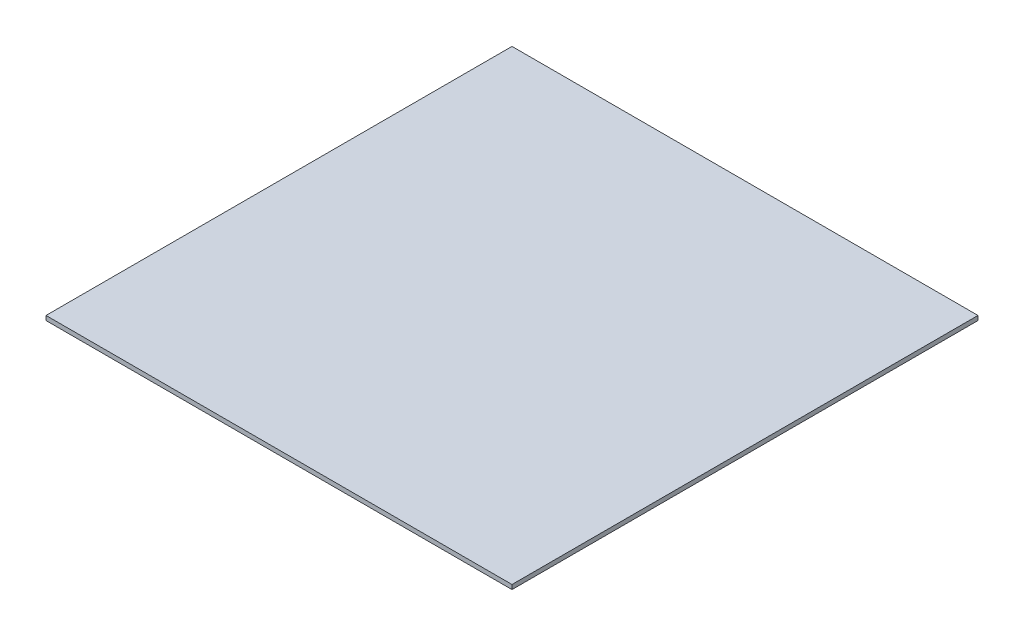
from build123d import *

# Parameters (mm, degrees)
ESQUISSE1_W        = 210
ESQUISSE1_H        = 210
BOSS_EXTRU_1_DEPTH = 2


with BuildPart() as part:
    # Esquisse1 → Boss.-Extru.1 (new body)
    with BuildSketch(Plane(origin=(0, 0, 0), x_dir=(1, 0, 0), z_dir=(0, 1, 0))):
        Rectangle(ESQUISSE1_W, ESQUISSE1_H)
    extrude(amount=BOSS_EXTRU_1_DEPTH)


solid = part.part
